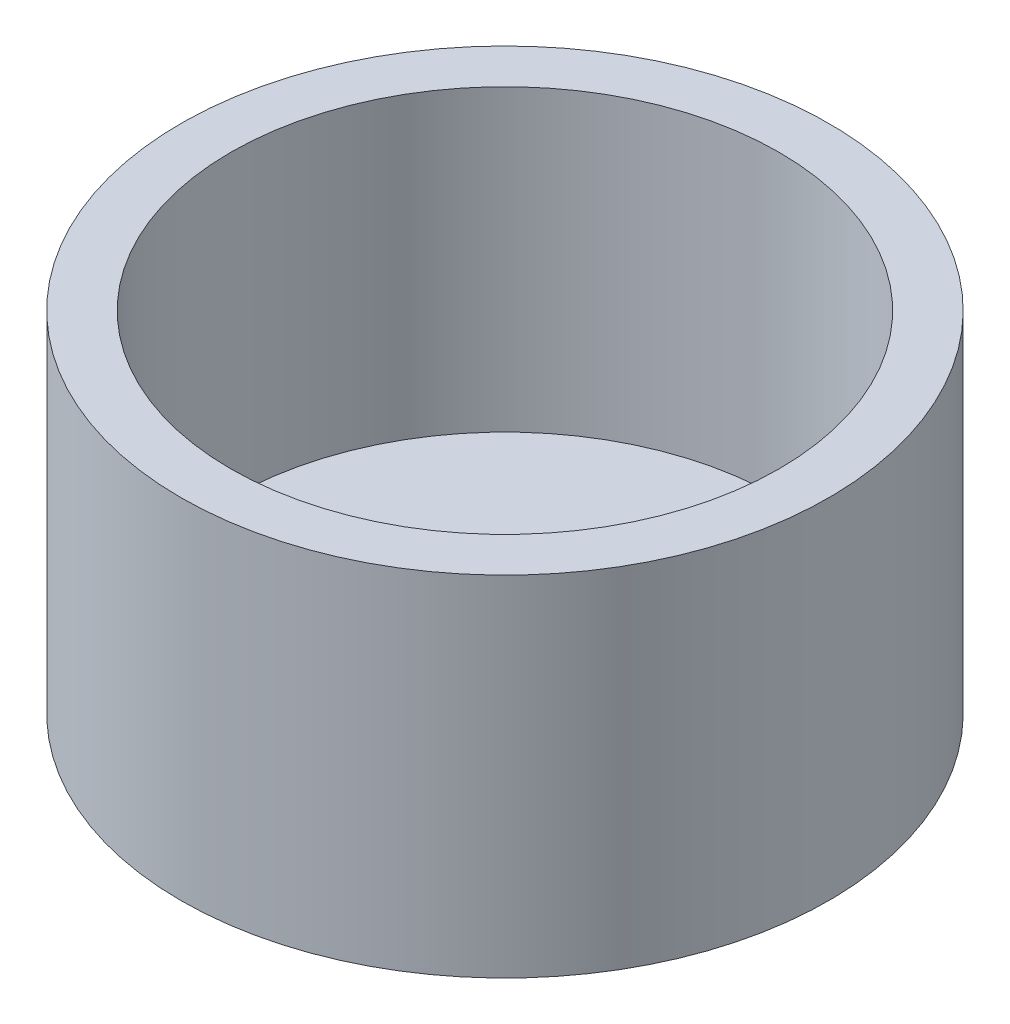
from build123d import *

# Parameters (mm, degrees)
SKETCH1_R           = 165.1
BOSS_EXTRUDE1_DEPTH = 25.4
SKETCH2_R           = 165.1
SKETCH2_R_2         = 139.7
BOSS_EXTRUDE2_DEPTH = 152.4


with BuildPart() as part:
    # Sketch1 → Boss-Extrude1 (new body)
    with BuildSketch(Plane(origin=(0, 0, 0), x_dir=(1, 0, 0), z_dir=(0, 1, 0))):
        with Locations(Location((0, 0, 0), (0, 0, 270))):
            Circle(SKETCH1_R)
    extrude(amount=BOSS_EXTRUDE1_DEPTH)

    # Sketch2 → Boss-Extrude2 (add)
    with BuildSketch(Plane(origin=(0, 25.4, 0), x_dir=(1, 0, 0), z_dir=(0, 1, 0))):
        with Locations(Location((0, 0, 0), (0, 0, 270))):
            Circle(SKETCH2_R)
        with Locations(Location((0, 0, 0), (0, 0, 90))):
            Circle(SKETCH2_R_2, mode=Mode.SUBTRACT)
    extrude(amount=BOSS_EXTRUDE2_DEPTH)


solid = part.part
